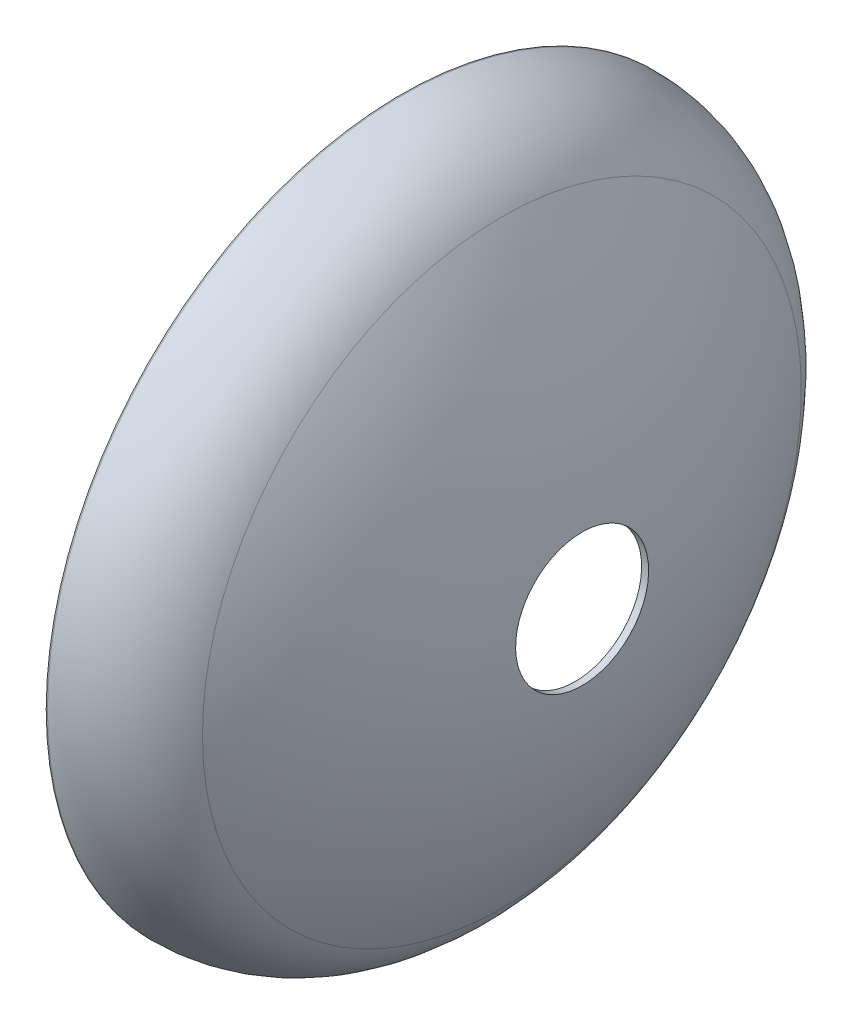
from build123d import *


with BuildPart() as part:
    # Эскиз1 → Повернуть1 (revolve)
    with BuildSketch(Plane.XY):
        with BuildLine():
            Line((0.348765499, 102), (0, 102))
            Line((0, 102), (0, 100))
            Line((0, 100), (0.348765499, 100))
            ThreePointArc((0.348765499, 100), (15.715348338, 95.980731584), (27.146090618, 84.952380952))
            ThreePointArc((27.146090618, 84.952380952), (42.06705822, 53.253307392), (49.87846865, 19.1))
            Line((49.87846865, 19.1), (51.892138751, 19.1))
            ThreePointArc((51.892138751, 19.1), (43.995996323, 53.794523258), (28.853763297, 85.993464052))
            ThreePointArc((28.853763297, 85.993464052), (16.694591362, 97.724601734), (0.348765499, 102))
        make_face()
    revolve(axis=Axis((0, 0, 0), (1, 0, 0)))


solid = part.part
